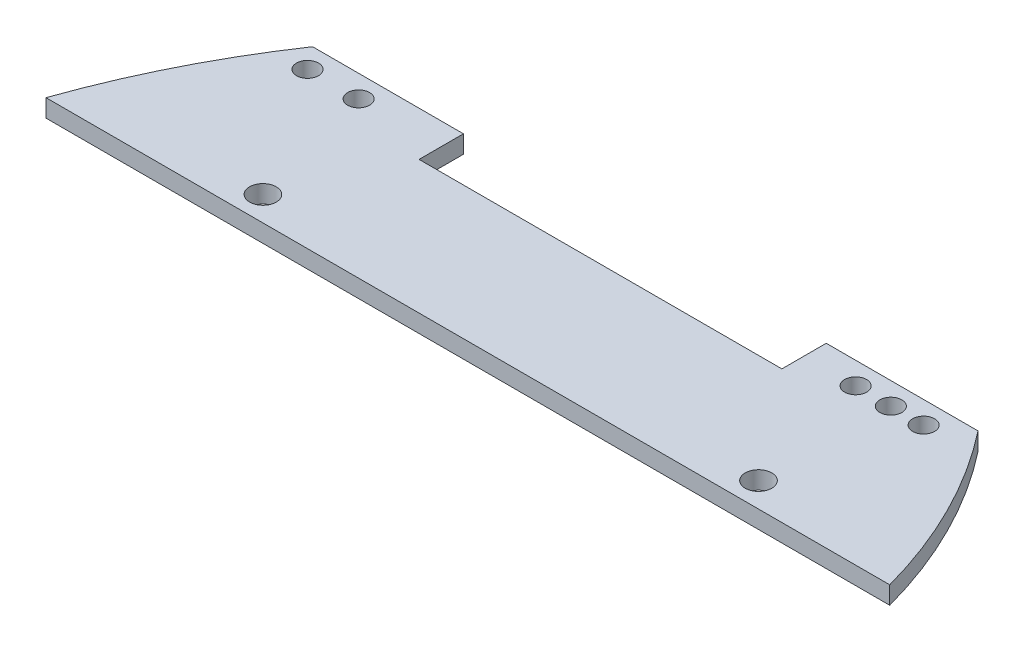
from build123d import *

# Parameters (mm, degrees)
BOSS_EXTRUDE1_DEPTH = 2
SKETCH2_W           = 40.894938579
SKETCH2_H           = 5
CUT_EXTRUDE1_DEPTH  = 2
SKETCH3_R           = 1.24
CUT_EXTRUDE2_DEPTH  = 2
SKETCH4_R           = 1.5
CUT_EXTRUDE3_DEPTH  = 2


with BuildPart() as part:
    # Sketch1 → Boss-Extrude1 (new body)
    with BuildSketch(Plane(origin=(0, 0, 0), x_dir=(1, 0, 0), z_dir=(0, 1, 0))):
        with BuildLine():
            Line((-37.5, 0), (37.5, 0))
            ThreePointArc((37.5, 0), (43.534594906, -9.492944386), (47.551323816, -20))
            Line((47.551323816, -20), (-47.551323816, -20))
            ThreePointArc((-47.551323816, -20), (-43.172342271, -9.675000313), (-37.5, 0))
        make_face()
    extrude(amount=BOSS_EXTRUDE1_DEPTH)

    # Sketch2 → Cut-Extrude1 (cut)
    with BuildSketch(Plane(origin=(0, 2, 0), x_dir=(1, 0, 0), z_dir=(0, 1, 0))):
        with Locations((-0.05253071, -2.5)):
            Rectangle(SKETCH2_W, SKETCH2_H)
    extrude(amount=-CUT_EXTRUDE1_DEPTH, mode=Mode.SUBTRACT)

    # Sketch3 → Cut-Extrude2 (cut)
    with BuildSketch(Plane(origin=(0, 2, 0), x_dir=(1, 0, 0), z_dir=(0, 1, 0))):
        with Locations(Location((-29.814825978, -2.5, 0), (0, 0, 270))):
            Circle(SKETCH3_R)
        with Locations(Location((26.204190081, -2.5, 0), (0, 0, 270))):
            Circle(SKETCH3_R)
        with Locations(Location((-35.574250481, -2.5, 0), (0, 0, 270))):
            Circle(SKETCH3_R)
        with Locations(Location((30.174605265, -2.5, 0), (0, 0, 270))):
            Circle(SKETCH3_R)
        with Locations(Location((33.86984316, -2.5, 0), (0, 0, 270))):
            Circle(SKETCH3_R)
    extrude(amount=-CUT_EXTRUDE2_DEPTH, mode=Mode.SUBTRACT)

    # Sketch4 → Cut-Extrude3 (cut)
    with BuildSketch(Plane(origin=(0, 2, 0), x_dir=(1, 0, 0), z_dir=(0, 1, 0))):
        with Locations(Location((-25.88031453, -17.219701094, 0), (0, 0, 270))):
            Circle(SKETCH4_R)
        with Locations(Location((29.979925966, -17.219701094, 0), (0, 0, 270))):
            Circle(SKETCH4_R)
    extrude(amount=-CUT_EXTRUDE3_DEPTH, mode=Mode.SUBTRACT)


solid = part.part
